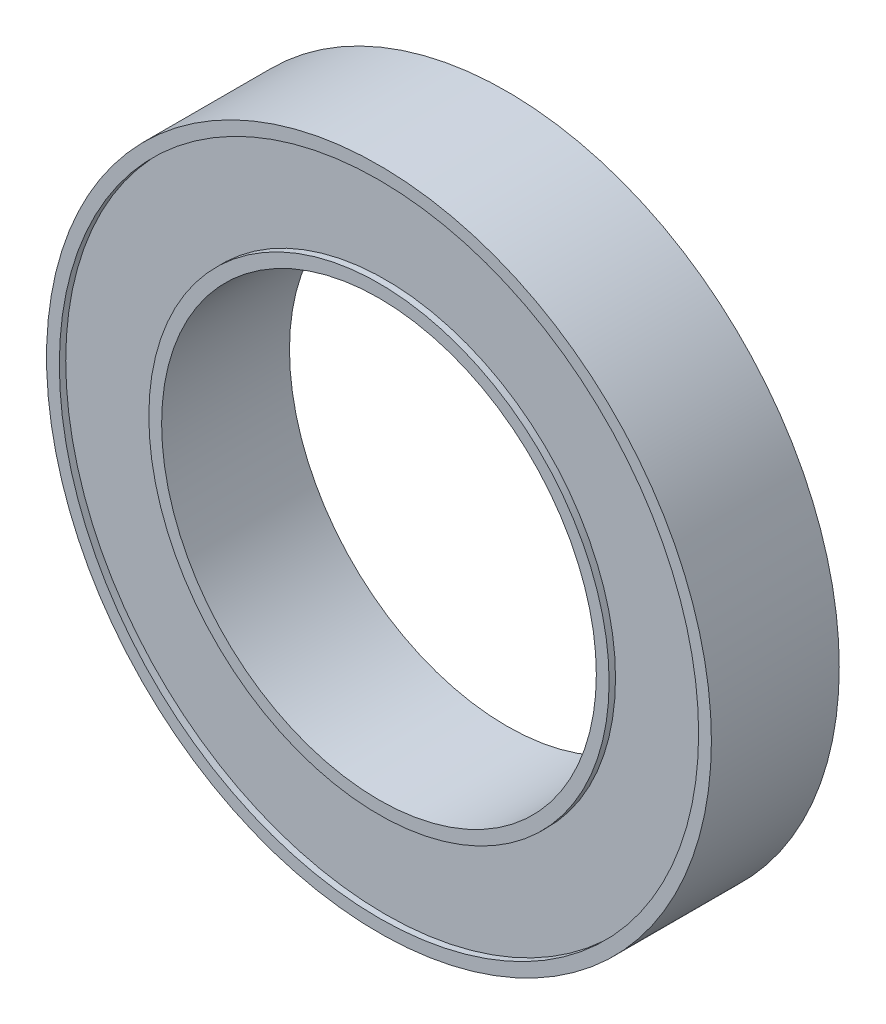
from build123d import *

# Parameters (mm, degrees)
SKETCH1_R           = 13
SKETCH1_R_2         = 8.5
BOSS_EXTRUDE1_DEPTH = 2.5
SKETCH2_R           = 12.5
SKETCH2_R_2         = 9
CUT_EXTRUDE1_DEPTH  = 0.25


with BuildPart() as part:
    # Sketch1 → Boss-Extrude1 (new, symmetric)
    with BuildSketch(Plane.XY):
        Circle(SKETCH1_R)
        Circle(SKETCH1_R_2, mode=Mode.SUBTRACT)
    extrude(amount=BOSS_EXTRUDE1_DEPTH, both=True)

    # Sketch2 → Cut-Extrude1 (cut)
    with BuildSketch(Plane.XY.offset(2.5)):
        Circle(SKETCH2_R)
        Circle(SKETCH2_R_2, mode=Mode.SUBTRACT)
    cut_extrude1 = extrude(amount=-CUT_EXTRUDE1_DEPTH, mode=Mode.SUBTRACT)

    # Mirror1: Cut-Extrude1 across plane
    add(cut_extrude1.mirror(Plane.XY), mode=Mode.SUBTRACT)


solid = part.part
